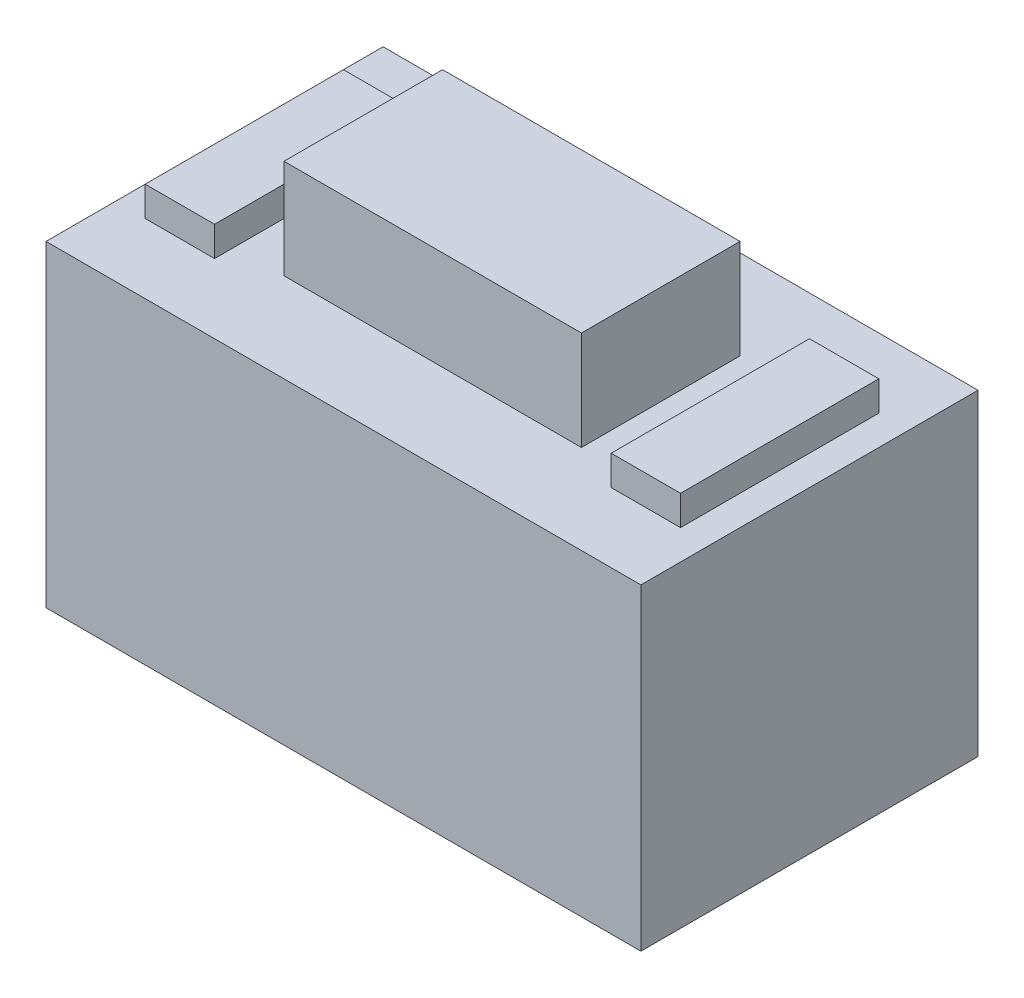
from build123d import *

# Parameters (mm, degrees)
SKICA1_W                = 6
SKICA1_H                = 3.2
P_IDAT_VYSUNUT_M1_DEPTH = 3.4
SKICA2_W                = 3
SKICA2_H                = 1.6
P_IDAT_VYSUNUT_M2_DEPTH = 1
SKICA3_W                = 0.7
SKICA3_H                = 2
P_IDAT_VYSUNUT_M3_DEPTH = 0.3


with BuildPart() as part:
    # Skica1 → Přidat vysunutím1 (new body)
    with BuildSketch(Plane.XY):
        Rectangle(SKICA1_W, SKICA1_H)
    extrude(amount=P_IDAT_VYSUNUT_M1_DEPTH)

    # Skica2 → Přidat vysunutím2 (add)
    with BuildSketch(Plane(origin=(0, 1.6, 0), x_dir=(1, 0, 0), z_dir=(0, 1, 0))):
        with Locations((0, -1.7)):
            Rectangle(SKICA2_W, SKICA2_H)
    extrude(amount=P_IDAT_VYSUNUT_M2_DEPTH)

    # Skica3 → Přidat vysunutím3 (add)
    with BuildSketch(Plane(origin=(0, 1.6, 0), x_dir=(1, 0, 0), z_dir=(0, 1, 0))):
        with Locations((-2.35, -1.7)):
            Rectangle(SKICA3_W, SKICA3_H)
        with Locations((2.35, -1.7)):
            Rectangle(SKICA3_W, SKICA3_H)
    extrude(amount=P_IDAT_VYSUNUT_M3_DEPTH)


solid = part.part
